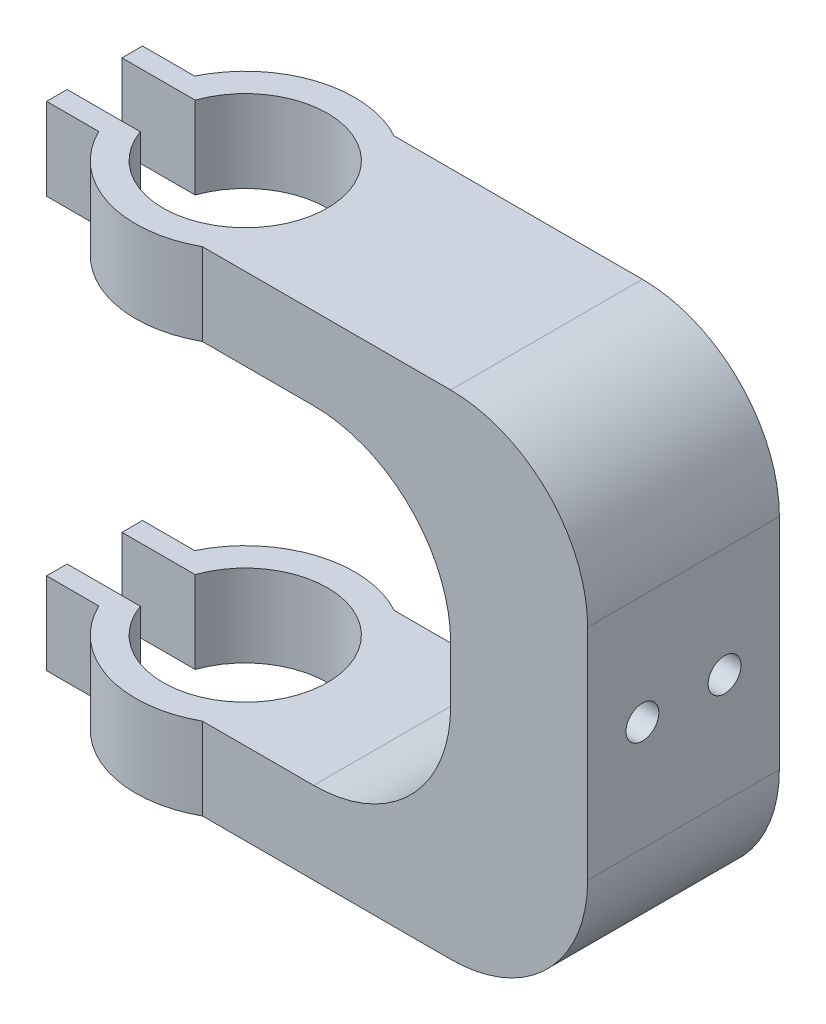
from build123d import *

# Parameters (mm, degrees)
BOSS_EXTRUDE1_DEPTH     = 3.5
SKETCH2_R               = 0.6
CUT_EXTRUDE1_DEPTH      = 18.839562775
CUT_EXTRUDE2_DEPTH      = 26.347583711
BOSS_EXTRUDE3_START     = -18
SKETCH8_R               = 3
BOSS_EXTRUDE3_DEPTH     = 18
CUT_EXTRUDE6_DEPTH      = 23.321514286
CUT_EXTRUDE6_DEPTH_BACK = 23.321514286
SKETCH9_W               = 14.986497077
SKETCH9_H               = 12
CUT_EXTRUDE8_DEPTH      = 27.47640459
FILLET1_R               = 5


with BuildPart() as part:
    # Sketch1 → Boss-Extrude1 (new, symmetric)
    with BuildSketch(Plane.XY):
        with BuildLine():
            Line((-7.5, 6), (-17.5, 6))
            Line((-17.5, 6), (-17.5, 9))
            Line((-17.5, 9), (2.5, 9))
            Line((2.5, 9), (2.5, -9))
            Line((2.5, -9), (-4.576098932, -9))
            Line((-4.576098932, -9), (-17.5, -9))
            Line((-17.5, -9), (-17.5, -6))
            Line((-17.5, -6), (-7.5, -6))
            ThreePointArc((-7.5, -6), (-3.964466094, -4.535533906), (-2.5, -1))
            Line((-2.5, -1), (-2.5, 1))
            ThreePointArc((-2.5, 1), (-3.964466094, 4.535533906), (-7.5, 6))
        make_face()
    extrude(amount=BOSS_EXTRUDE1_DEPTH, both=True)

    # Sketch2 → Cut-Extrude1 (cut, through all)
    with BuildSketch(Plane.ZY.offset(2.5)):
        with Locations((1.5, 0)):
            Circle(SKETCH2_R)
        with Locations((-1.5, 0)):
            Circle(SKETCH2_R)
    extrude(amount=-CUT_EXTRUDE1_DEPTH, mode=Mode.SUBTRACT)

    # Sketch3 → Cut-Extrude2 (cut, through all)
    with BuildSketch(Plane(origin=(0, 9, 0), x_dir=(1, 0, 0), z_dir=(0, 1, 0))):
        with BuildLine():
            Line((-18.680784021, 1), (-16.328427125, 1))
            ThreePointArc((-16.328427125, 1), (-10.5, 0), (-16.328427125, -1))
            Line((-16.328427125, -1), (-18.680784021, -1))
            Line((-18.680784021, -1), (-18.680784021, 1))
        make_face()
    extrude(amount=-CUT_EXTRUDE2_DEPTH, mode=Mode.SUBTRACT)

    # Sketch8 → Boss-Extrude3 (add)
    with BuildSketch(Plane(origin=(0, 9, 0), x_dir=(1, 0, 0), z_dir=(0, 1, 0)).offset(BOSS_EXTRUDE3_START)):
        with BuildLine():
            Line((-17.372983346, 1), (-19, 1))
            Line((-19, 1), (-19, 1.75))
            Line((-19, 1.75), (-17.096873642, 1.75))
            ThreePointArc((-17.096873642, 1.75), (-9.5, 0), (-17.096873642, -1.75))
            Line((-17.096873642, -1.75), (-19, -1.75))
            Line((-19, -1.75), (-19, -1))
            Line((-19, -1), (-17.372983346, -1))
            ThreePointArc((-17.372983346, -1), (-17.5, 0), (-17.372983346, 1))
        make_face()
        with Locations(Location((-13.5, 0, 0), (0, 0, 180))):
            Circle(SKETCH8_R, mode=Mode.SUBTRACT)
    extrude(amount=BOSS_EXTRUDE3_DEPTH)

    # Sketch9 → Cut-Extrude6 (cut, two sides: drawn at the far end of the back side and taken through both)
    with BuildSketch(Plane(origin=(0, 0, -3.5), x_dir=(-1, 0, 0), z_dir=(0, 0, -1)).offset(-CUT_EXTRUDE6_DEPTH_BACK)):
        with Locations((14.993248539, 0)):
            Rectangle(SKETCH9_W, SKETCH9_H)
    extrude(amount=CUT_EXTRUDE6_DEPTH + CUT_EXTRUDE6_DEPTH_BACK, mode=Mode.SUBTRACT)

    # Sketch10 → Cut-Extrude8 (cut, through all)
    with BuildSketch(Plane(origin=(0, 9, 0), x_dir=(1, 0, 0), z_dir=(0, 1, 0))):
        with BuildLine():
            Line((-17.5, 1.75), (-17.096873642, 1.75))
            ThreePointArc((-17.096873642, 1.75), (-16.401750839, 2.753151298), (-15.436491673, 3.5))
            Line((-15.436491673, 3.5), (-17.5, 3.5))
            Line((-17.5, 3.5), (-17.5, 1.75))
        make_face()
        with BuildLine():
            Line((-17.5, -1.75), (-17.096873642, -1.75))
            ThreePointArc((-17.096873642, -1.75), (-16.401750839, -2.753151298), (-15.436491673, -3.5))
            Line((-15.436491673, -3.5), (-17.5, -3.5))
            Line((-17.5, -3.5), (-17.5, -1.75))
        make_face()
        with BuildLine():
            Line((-17.372983346, -1), (-16.328427125, -1))
            ThreePointArc((-16.328427125, -1), (-16.5, 0), (-16.328427125, 1))
            Line((-16.328427125, 1), (-17.372983346, 1))
            ThreePointArc((-17.372983346, 1), (-17.5, 0), (-17.372983346, -1))
        make_face()
    extrude(amount=-CUT_EXTRUDE8_DEPTH, mode=Mode.SUBTRACT)

    # Fillet1
    fillet1_edges = [part.edges().sort_by_distance(p)[0] for p in [
        (2.5, 9, 0),
        (2.5, -9, 0),
    ]]
    fillet(fillet1_edges, radius=FILLET1_R)


solid = part.part
